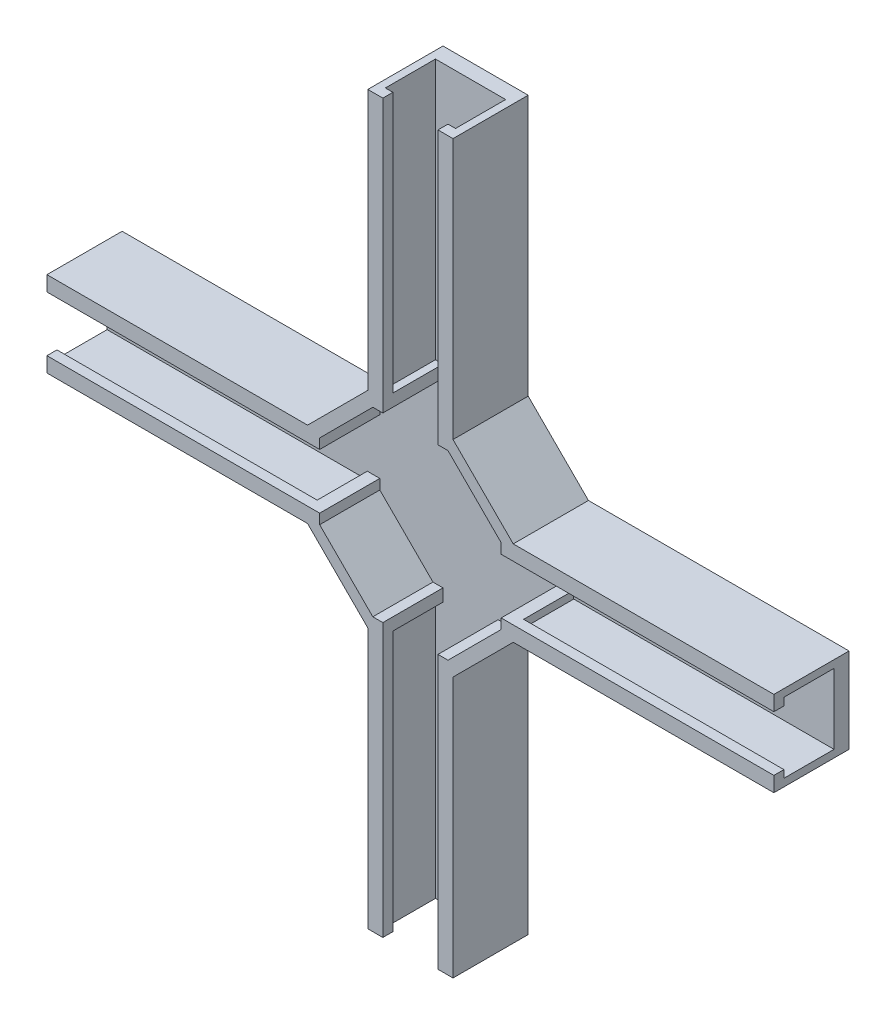
from build123d import *

# Parameters (mm, degrees)
SKETCH_1_W          = 52
SKETCH_1_H          = 17
SKETCH_1_W_2        = 17
SKETCH_1_H_2        = 52
EXTRUDE_1_DEPTH     = 15
SKETCH_8_W          = 11
SKETCH_8_H          = 54.414213562
SKETCH_8_W_2        = 54.414213562
SKETCH_8_H_2        = 11
CUT_EXTRUDE_2_DEPTH = 12
SKETCH_9_W          = 51.918987987
SKETCH_9_H          = 14
SKETCH_9_W_2        = 14
SKETCH_9_H_2        = 51.960636612
SKETCH_9_W_3        = 51.935924336
SKETCH_9_H_3        = 51.948438094
CUT_EXTRUDE_3_DEPTH = 10


with BuildPart() as part:
    # Эскиз1 → Бобышка-Вытянуть1 (new body)
    with BuildSketch(Plane.XY):
        with Locations((-46.52081528, 0)):
            Rectangle(SKETCH_1_W, SKETCH_1_H)
        Polygon((20.52081528, 8.5), (20.52081528, -8.5), (8.5, -20.52081528), (-8.5, -20.52081528), (-20.52081528, -8.5), (-20.52081528, 8.5), (-8.5, 20.52081528), (8.5, 20.52081528), align=None)
        with Locations((0, 46.52081528)):
            Rectangle(SKETCH_1_W_2, SKETCH_1_H_2)
        with Locations((46.52081528, 0)):
            Rectangle(SKETCH_1_W, SKETCH_1_H)
        with Locations((0, -46.52081528)):
            Rectangle(SKETCH_1_W_2, SKETCH_1_H_2)
    extrude(amount=EXTRUDE_1_DEPTH)

    # Эскиз8 → Вырез-Вытянуть2 (cut)
    with BuildSketch(Plane.XY.offset(15)):
        with Locations((0, 45.313708499)):
            Rectangle(SKETCH_8_W, SKETCH_8_H)
        Polygon((7.5, -18.106601718), (18.106601718, -7.5), (18.106601718, 7.5), (7.5, 18.106601718), (-7.5, 18.106601718), (-18.106601718, 7.5), (-18.106601718, -7.5), (-7.5, -18.106601718), align=None)
        with Locations((45.313708499, 0)):
            Rectangle(SKETCH_8_W_2, SKETCH_8_H_2)
        with Locations((0, -45.313708499)):
            Rectangle(SKETCH_8_W, SKETCH_8_H)
        with Locations((-45.313708499, 0)):
            Rectangle(SKETCH_8_W_2, SKETCH_8_H_2)
    extrude(amount=-CUT_EXTRUDE_2_DEPTH, mode=Mode.SUBTRACT)

    # Эскиз9 → Вырез-Вытянуть3 (cut)
    with BuildSketch(Plane.XY.offset(3)):
        with Locations((-46.561321287, 0)):
            Rectangle(SKETCH_9_W, SKETCH_9_H)
        with Locations((0, 46.540496974)):
            Rectangle(SKETCH_9_W_2, SKETCH_9_H_2)
        with Locations((46.552853112, 0)):
            Rectangle(SKETCH_9_W_3, SKETCH_9_H)
        with Locations((0, -46.546596233)):
            Rectangle(SKETCH_9_W_2, SKETCH_9_H_3)
    extrude(amount=CUT_EXTRUDE_3_DEPTH, mode=Mode.SUBTRACT)


solid = part.part
